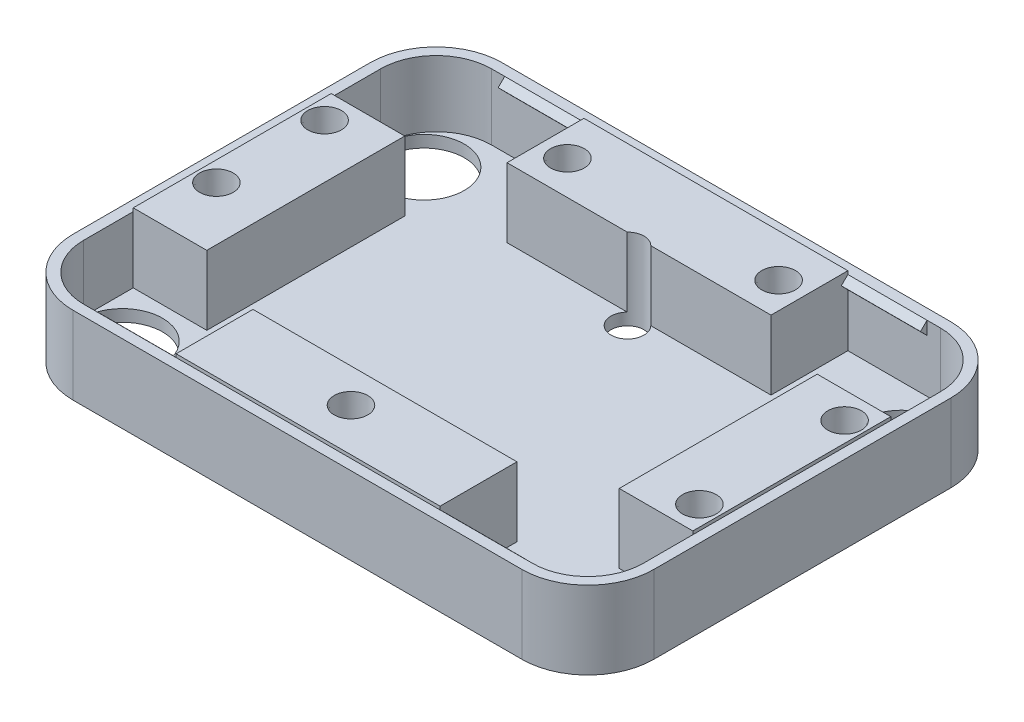
from build123d import *

# Parameters (mm, degrees)
SKETCH1_W                                = 88
SKETCH1_H                                = 65
BOSS_EXTRUDE2_DEPTH                      = 1.8
FILLET1_R                                = 10
F_12_2_12_2_DIAMETER_HOLE1_D             = 12.2
BOSS_EXTRUDE3_START                      = 10
BOSS_EXTRUDE3_DEPTH                      = 10
SKETCH5_W                                = 40
SKETCH5_H                                = 11.65
SKETCH5_W_2                              = 11.15
SKETCH5_H_2                              = 30
BOSS_EXTRUDE4_DEPTH                      = 10.5
SKETCH6_R                                = 2.55
CUT_EXTRUDE1_DEPTH                       = 5
CUT_EXTRUDE1_DRAFT                       = -2
CUT_EXTRUDE1_PROFILE_2_DEPTH             = 5
CUT_EXTRUDE1_PROFILE_2_DRAFT             = -2
CUT_EXTRUDE1_PROFILE_3_DEPTH             = 5
CUT_EXTRUDE1_PROFILE_3_DRAFT             = -2
CUT_EXTRUDE1_PROFILE_4_DEPTH             = 5
CUT_EXTRUDE1_PROFILE_4_DRAFT             = -2
CUT_EXTRUDE1_PROFILE_5_DEPTH             = 5
CUT_EXTRUDE1_PROFILE_5_DRAFT             = -2
CUT_EXTRUDE1_PROFILE_6_DEPTH             = 5
CUT_EXTRUDE1_PROFILE_6_DRAFT             = -2
CUT_EXTRUDE1_PROFILE_7_DEPTH             = 5
CUT_EXTRUDE1_PROFILE_7_DRAFT             = -2
SKETCH7_R                                = 2.5
CUT_EXTRUDE2_DEPTH                       = 111.092188642
BOSS_EXTRUDE5_DEPTH                      = 12
MIRROR1_AT_THE_SECOND_PLANE_COPY_1_DEPTH = 12


with BuildPart() as part:
    # Sketch1 → Boss-Extrude2 (new body)
    with BuildSketch(Plane(origin=(0, 0, 0), x_dir=(1, 0, 0), z_dir=(0, 1, 0))):
        with Locations((44, 32.5)):
            Rectangle(SKETCH1_W, SKETCH1_H)
    extrude(amount=BOSS_EXTRUDE2_DEPTH)

    # Fillet1
    fillet1_edges = [part.edges().sort_by_distance(p)[0] for p in [
        (0, 0.9, -65),
        (88, 0.9, -65),
        (88, 0.9, 0),
        (0, 0.9, 0),
    ]]
    fillet(fillet1_edges, radius=FILLET1_R)

    # Ø12.2 (12.2) Diameter Hole1 (through all)
    with Locations(Plane(origin=(0, 1.8, 0), x_dir=(1, 0, 0), z_dir=(0, 1, 0))):
        with Locations((7.805, 55.36), (80.195, 55.36), (7.805, 9.64), (80.195, 9.64)):
            Hole(F_12_2_12_2_DIAMETER_HOLE1_D / 2)

    # Sketch4 → Boss-Extrude3 (add)
    with BuildSketch(Plane(origin=(0, 1.8, 0), x_dir=(1, 0, 0), z_dir=(0, 1, 0)).offset(BOSS_EXTRUDE3_START)):
        with BuildLine():
            Line((78, 65), (10, 65))
            ThreePointArc((10, 65), (2.928932188, 62.071067812), (0, 55))
            Line((0, 55), (0, 10))
            ThreePointArc((0, 10), (2.928932188, 2.928932188), (10, 0))
            Line((10, 0), (78, 0))
            ThreePointArc((78, 0), (85.071067812, 2.928932188), (88, 10))
            Line((88, 10), (88, 55))
            ThreePointArc((88, 55), (85.071067812, 62.071067812), (78, 65))
        make_face()
        with BuildLine():
            Line((78, 63.4), (10, 63.4))
            ThreePointArc((10, 63.4), (4.060303038, 60.939696962), (1.6, 55))
            Line((1.6, 55), (1.6, 10))
            ThreePointArc((1.6, 10), (4.060303038, 4.060303038), (10, 1.6))
            Line((10, 1.6), (78, 1.6))
            ThreePointArc((78, 1.6), (83.939696962, 4.060303038), (86.4, 10))
            Line((86.4, 10), (86.4, 55))
            ThreePointArc((86.4, 55), (83.939696962, 60.939696962), (78, 63.4))
        make_face(mode=Mode.SUBTRACT)
    extrude(amount=-BOSS_EXTRUDE3_DEPTH)

    # Sketch5 → Boss-Extrude4 (add)
    with BuildSketch(Plane(origin=(0, 1.8, 0), x_dir=(1, 0, 0), z_dir=(0, 1, 0))):
        with Locations((44, 57.575)):
            Rectangle(SKETCH5_W, SKETCH5_H)
        with Locations((44, 7.425)):
            Rectangle(SKETCH5_W, SKETCH5_H)
        with Locations((80.825, 32.5)):
            Rectangle(SKETCH5_W_2, SKETCH5_H_2)
        with Locations((7.175, 32.5)):
            Rectangle(SKETCH5_W_2, SKETCH5_H_2)
    extrude(amount=BOSS_EXTRUDE4_DEPTH)


with BuildPart() as cut_extrude1_tool:
    # Sketch6 → Cut-Extrude1 (with draft: the straight prism first)
    with BuildSketch(Plane(origin=(0, 12.3, 0), x_dir=(1, 0, 0), z_dir=(0, 1, 0))):
        with Locations((60, 56.9)):
            Circle(SKETCH6_R)
    extrude(amount=-CUT_EXTRUDE1_DEPTH)
    # Cut-Extrude1: the draft: its side faces are tilted about the plane it starts from
    cut_extrude1_sides = [cut_extrude1_tool.faces().sort_by_distance(p)[0] for p in [
        (57.45, 9.8, -56.9),
    ]]
    draft(cut_extrude1_sides, Plane(origin=(0, 12.3, 0), x_dir=(1, 0, 0), z_dir=(0, 1, 0)), CUT_EXTRUDE1_DRAFT)


with BuildPart() as part_1:
    add(part.part)

    # Cut-Extrude1: cut by cut_extrude1_tool
    add(cut_extrude1_tool.part, mode=Mode.SUBTRACT)


with BuildPart() as cut_extrude1_profile_2_tool:
    # Sketch6 → Cut-Extrude1 profile 2 (with draft: the straight prism first)
    with BuildSketch(Plane(origin=(0, 12.3, 0), x_dir=(1, 0, 0), z_dir=(0, 1, 0))):
        with Locations((28, 56.9)):
            Circle(SKETCH6_R)
    extrude(amount=-CUT_EXTRUDE1_PROFILE_2_DEPTH)
    # Cut-Extrude1 profile 2: the draft: its side faces are tilted about the plane it starts from
    cut_extrude1_profile_2_sides = [cut_extrude1_profile_2_tool.faces().sort_by_distance(p)[0] for p in [
        (25.45, 9.8, -56.9),
    ]]
    draft(cut_extrude1_profile_2_sides, Plane(origin=(0, 12.3, 0), x_dir=(1, 0, 0), z_dir=(0, 1, 0)), CUT_EXTRUDE1_PROFILE_2_DRAFT)


with BuildPart() as part_2:
    add(part_1.part)

    # Cut-Extrude1 profile 2: cut by cut_extrude1_profile_2_tool
    add(cut_extrude1_profile_2_tool.part, mode=Mode.SUBTRACT)


with BuildPart() as cut_extrude1_profile_3_tool:
    # Sketch6 → Cut-Extrude1 profile 3 (with draft: the straight prism first)
    with BuildSketch(Plane(origin=(0, 12.3, 0), x_dir=(1, 0, 0), z_dir=(0, 1, 0))):
        with Locations((4.6, 43.5)):
            Circle(SKETCH6_R)
    extrude(amount=-CUT_EXTRUDE1_PROFILE_3_DEPTH)
    # Cut-Extrude1 profile 3: the draft: its side faces are tilted about the plane it starts from
    cut_extrude1_profile_3_sides = [cut_extrude1_profile_3_tool.faces().sort_by_distance(p)[0] for p in [
        (2.05, 9.8, -43.5),
    ]]
    draft(cut_extrude1_profile_3_sides, Plane(origin=(0, 12.3, 0), x_dir=(1, 0, 0), z_dir=(0, 1, 0)), CUT_EXTRUDE1_PROFILE_3_DRAFT)


with BuildPart() as part_3:
    add(part_2.part)

    # Cut-Extrude1 profile 3: cut by cut_extrude1_profile_3_tool
    add(cut_extrude1_profile_3_tool.part, mode=Mode.SUBTRACT)


with BuildPart() as cut_extrude1_profile_4_tool:
    # Sketch6 → Cut-Extrude1 profile 4 (with draft: the straight prism first)
    with BuildSketch(Plane(origin=(0, 12.3, 0), x_dir=(1, 0, 0), z_dir=(0, 1, 0))):
        with Locations((4.6, 27.106324955)):
            Circle(SKETCH6_R)
    extrude(amount=-CUT_EXTRUDE1_PROFILE_4_DEPTH)
    # Cut-Extrude1 profile 4: the draft: its side faces are tilted about the plane it starts from
    cut_extrude1_profile_4_sides = [cut_extrude1_profile_4_tool.faces().sort_by_distance(p)[0] for p in [
        (2.05, 9.8, -27.106324955),
    ]]
    draft(cut_extrude1_profile_4_sides, Plane(origin=(0, 12.3, 0), x_dir=(1, 0, 0), z_dir=(0, 1, 0)), CUT_EXTRUDE1_PROFILE_4_DRAFT)


with BuildPart() as part_4:
    add(part_3.part)

    # Cut-Extrude1 profile 4: cut by cut_extrude1_profile_4_tool
    add(cut_extrude1_profile_4_tool.part, mode=Mode.SUBTRACT)


with BuildPart() as cut_extrude1_profile_5_tool:
    # Sketch6 → Cut-Extrude1 profile 5 (with draft: the straight prism first)
    with BuildSketch(Plane(origin=(0, 12.3, 0), x_dir=(1, 0, 0), z_dir=(0, 1, 0))):
        with Locations((83.4, 21.5)):
            Circle(SKETCH6_R)
    extrude(amount=-CUT_EXTRUDE1_PROFILE_5_DEPTH)
    # Cut-Extrude1 profile 5: the draft: its side faces are tilted about the plane it starts from
    cut_extrude1_profile_5_sides = [cut_extrude1_profile_5_tool.faces().sort_by_distance(p)[0] for p in [
        (80.85, 9.8, -21.5),
    ]]
    draft(cut_extrude1_profile_5_sides, Plane(origin=(0, 12.3, 0), x_dir=(1, 0, 0), z_dir=(0, 1, 0)), CUT_EXTRUDE1_PROFILE_5_DRAFT)


with BuildPart() as part_5:
    add(part_4.part)

    # Cut-Extrude1 profile 5: cut by cut_extrude1_profile_5_tool
    add(cut_extrude1_profile_5_tool.part, mode=Mode.SUBTRACT)


with BuildPart() as cut_extrude1_profile_6_tool:
    # Sketch6 → Cut-Extrude1 profile 6 (with draft: the straight prism first)
    with BuildSketch(Plane(origin=(0, 12.3, 0), x_dir=(1, 0, 0), z_dir=(0, 1, 0))):
        with Locations((83.4, 43.5)):
            Circle(SKETCH6_R)
    extrude(amount=-CUT_EXTRUDE1_PROFILE_6_DEPTH)
    # Cut-Extrude1 profile 6: the draft: its side faces are tilted about the plane it starts from
    cut_extrude1_profile_6_sides = [cut_extrude1_profile_6_tool.faces().sort_by_distance(p)[0] for p in [
        (80.85, 9.8, -43.5),
    ]]
    draft(cut_extrude1_profile_6_sides, Plane(origin=(0, 12.3, 0), x_dir=(1, 0, 0), z_dir=(0, 1, 0)), CUT_EXTRUDE1_PROFILE_6_DRAFT)


with BuildPart() as part_6:
    add(part_5.part)

    # Cut-Extrude1 profile 6: cut by cut_extrude1_profile_6_tool
    add(cut_extrude1_profile_6_tool.part, mode=Mode.SUBTRACT)


with BuildPart() as cut_extrude1_profile_7_tool:
    # Sketch6 → Cut-Extrude1 profile 7 (with draft: the straight prism first)
    with BuildSketch(Plane(origin=(0, 12.3, 0), x_dir=(1, 0, 0), z_dir=(0, 1, 0))):
        with Locations((44, 8.1)):
            Circle(SKETCH6_R)
    extrude(amount=-CUT_EXTRUDE1_PROFILE_7_DEPTH)
    # Cut-Extrude1 profile 7: the draft: its side faces are tilted about the plane it starts from
    cut_extrude1_profile_7_sides = [cut_extrude1_profile_7_tool.faces().sort_by_distance(p)[0] for p in [
        (41.45, 9.8, -8.1),
    ]]
    draft(cut_extrude1_profile_7_sides, Plane(origin=(0, 12.3, 0), x_dir=(1, 0, 0), z_dir=(0, 1, 0)), CUT_EXTRUDE1_PROFILE_7_DRAFT)


with BuildPart() as part_7:
    add(part_6.part)

    # Cut-Extrude1 profile 7: cut by cut_extrude1_profile_7_tool
    add(cut_extrude1_profile_7_tool.part, mode=Mode.SUBTRACT)

    # Sketch7 → Cut-Extrude2 (cut, through all)
    with BuildSketch(Plane.XZ):
        with Locations(Location((44, -50, 0), (0, 0, 270))):
            Circle(SKETCH7_R)
    extrude(amount=-CUT_EXTRUDE2_DEPTH, mode=Mode.SUBTRACT)

    # Sketch8 → Boss-Extrude5 (add)
    with BuildSketch(Plane.ZY.offset(-24)):
        Polygon((-1.6, 9.799528107), (-1.6, 11.8), (-2.6, 10.821488431), align=None)
    boss_extrude5 = extrude(amount=BOSS_EXTRUDE5_DEPTH)

    # Mirror1: Boss-Extrude5 across plane
    add(boss_extrude5.mirror(Plane.XY.offset(-32.5)))

    # Mirror1 at the second plane: Boss-Extrude5 across plane
    add(boss_extrude5.mirror(Plane.ZY.offset(-44)))

    # Mirror1 at the second plane copy 1 sketc → Mirror1 at the second plane copy 1 (add)
    with BuildSketch(Plane(origin=(64, 0, -65), x_dir=(0, 0, -1), z_dir=(1, 0, 0))):
        Polygon((-1.6, 9.799528107), (-1.6, 11.8), (-2.6, 10.821488431), align=None)
    extrude(amount=MIRROR1_AT_THE_SECOND_PLANE_COPY_1_DEPTH)


solid = part_7.part
